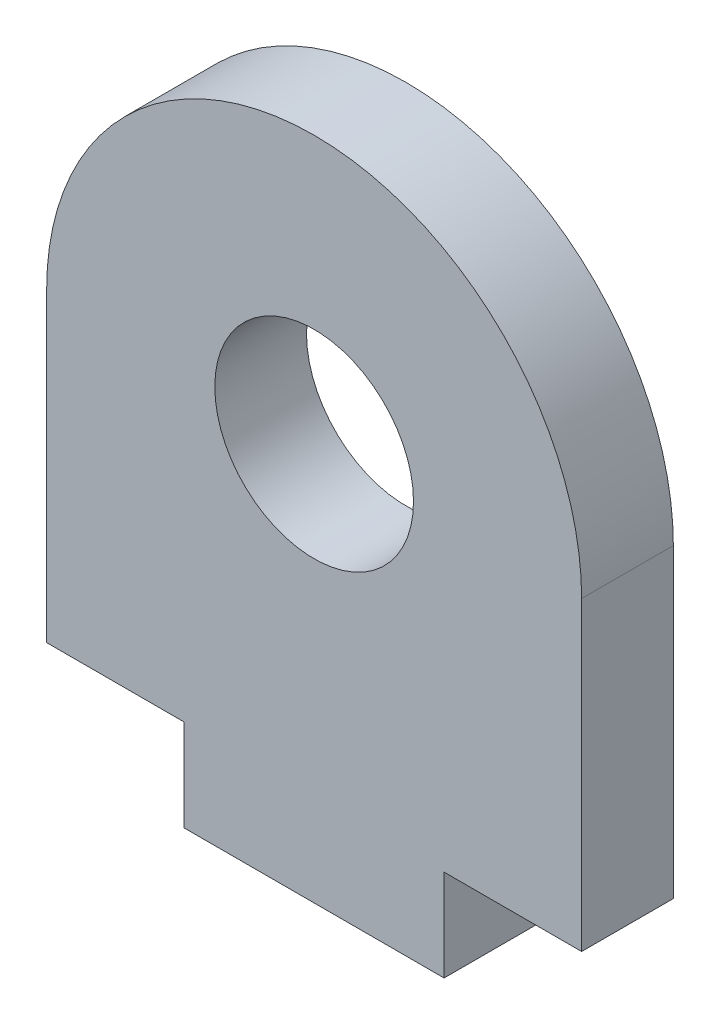
from build123d import *

# Parameters (mm, degrees)
SKETCH1_R           = 6.5
BOSS_EXTRUDE1_DEPTH = 6


with BuildPart() as part:
    # Sketch1 → Boss-Extrude1 (new body)
    with BuildSketch(Plane.XY):
        with BuildLine():
            Line((-17.5, 0), (-17.5, -20))
            Line((-17.5, -20), (-8.5, -20))
            Line((-8.5, -20), (-8.5, -26))
            Line((-8.5, -26), (8.5, -26))
            Line((8.5, -26), (8.5, -20))
            Line((8.5, -20), (17.5, -20))
            Line((17.5, -20), (17.5, 0))
            ThreePointArc((17.5, 0), (0, 17.5), (-17.5, 0))
        make_face()
        Circle(SKETCH1_R, mode=Mode.SUBTRACT)
    extrude(amount=BOSS_EXTRUDE1_DEPTH)


solid = part.part
